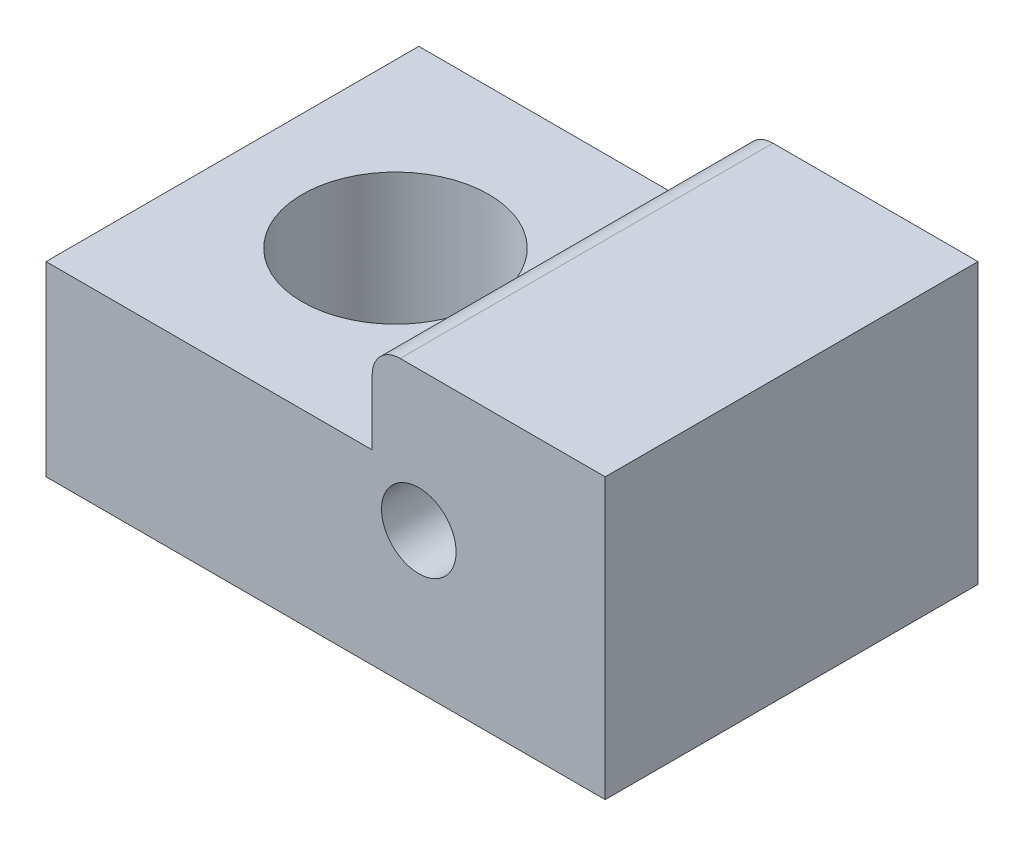
from build123d import *

# Parameters (mm, degrees)
SKETCH_1_R          = 4
EXTRUDE_1_DEPTH     = 40
CUT_EXTRUDE_START   = 5
SKETCH_2_R          = 10
CUT_EXTRUDE_1_DEPTH = 40


with BuildPart() as part:
    # 草图1 → 凸台-拉伸1 (new body)
    with BuildSketch(Plane.XY):
        with BuildLine():
            Line((8, 15), (30, 15))
            Line((30, 15), (30, -15))
            Line((30, -15), (-30, -15))
            Line((-30, -15), (-30, 5))
            Line((-30, 5), (5, 5))
            Line((5, 5), (5, 12))
            ThreePointArc((5, 12), (5.878679656, 14.121320344), (8, 15))
        make_face()
        with Locations((10, 0)):
            Circle(SKETCH_1_R, mode=Mode.SUBTRACT)
    extrude(amount=EXTRUDE_1_DEPTH)

    # 草图2 → 切除-拉伸1 (cut)
    with BuildSketch(Plane(origin=(0, 0, 0), x_dir=(1, 0, 0), z_dir=(0, 1, 0)).offset(CUT_EXTRUDE_START)):
        with Locations(Location((-12.5, -20, 0), (0, 0, 270))):
            Circle(SKETCH_2_R)
    extrude(amount=-CUT_EXTRUDE_1_DEPTH, mode=Mode.SUBTRACT)


solid = part.part
